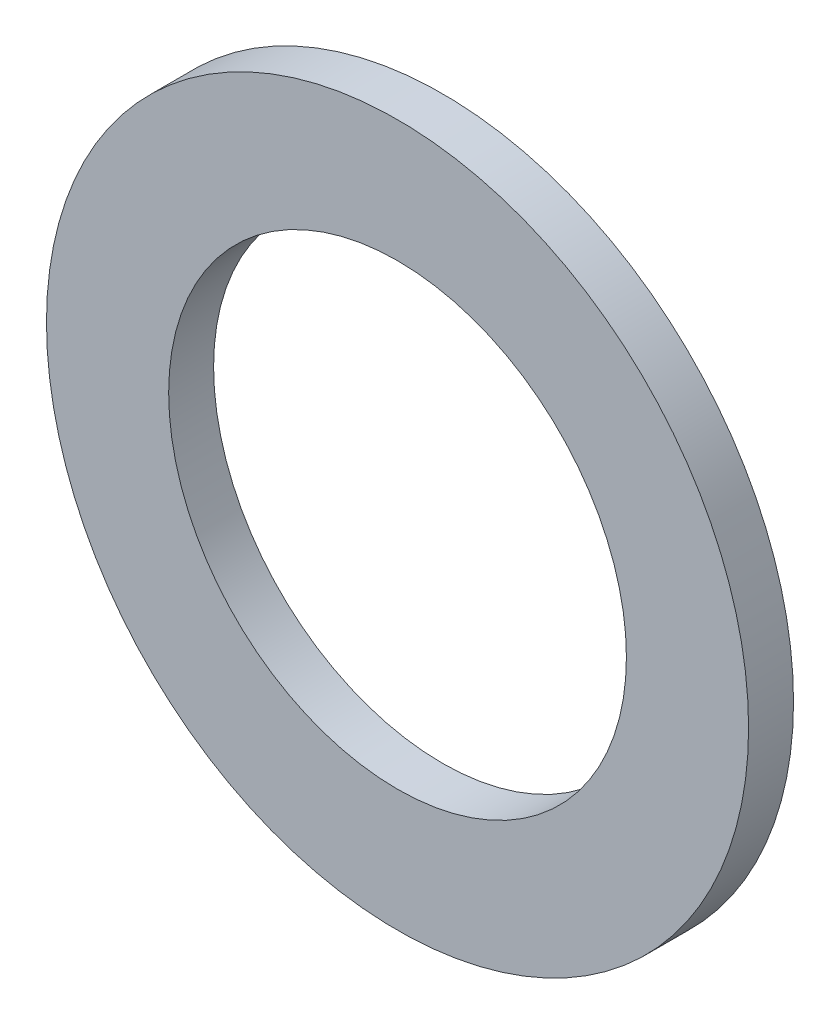
from build123d import *

# Parameters (mm, degrees)
SKETCH1_W = 1.016
SKETCH1_H = 2.7625


with BuildPart() as part:
    # Sketch1 → Revolve1 (revolve)
    with BuildSketch(Plane(origin=(0, 0, 0), x_dir=(0, 0, -1), z_dir=(1, 0, 0)), mode=Mode.PRIVATE) as revolve1_sk:
        with Locations((0.508, 6.55625)):
            Rectangle(SKETCH1_W, SKETCH1_H)
    revolve(revolve1_sk.sketch.rotate(Axis((0, 0, 3.110701917), (0, 0, -1)), 90), axis=Axis((0, 0, 3.110701917), (0, 0, -1)))


solid = part.part
